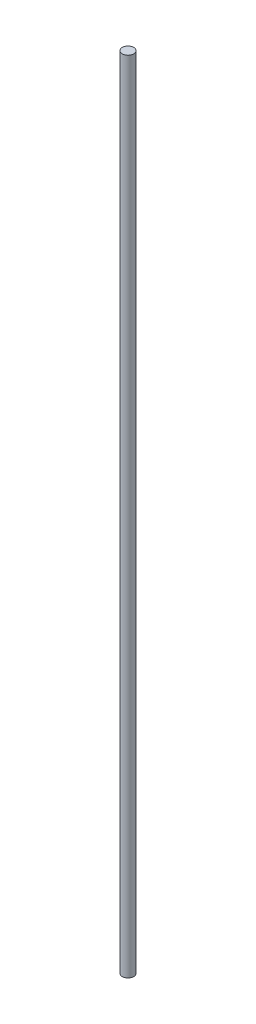
from build123d import *

# Parameters (mm, degrees)
SKETCH1_R           = 3.96875
BOSS_EXTRUDE1_DEPTH = 558.8


with BuildPart() as part:
    # Sketch1 → Boss-Extrude1 (new body)
    with BuildSketch(Plane(origin=(0, 0, 0), x_dir=(1, 0, 0), z_dir=(0, 1, 0))):
        with Locations(Location((0, 0, 0), (0, 0, 270))):
            Circle(SKETCH1_R)
    extrude(amount=BOSS_EXTRUDE1_DEPTH)


solid = part.part
